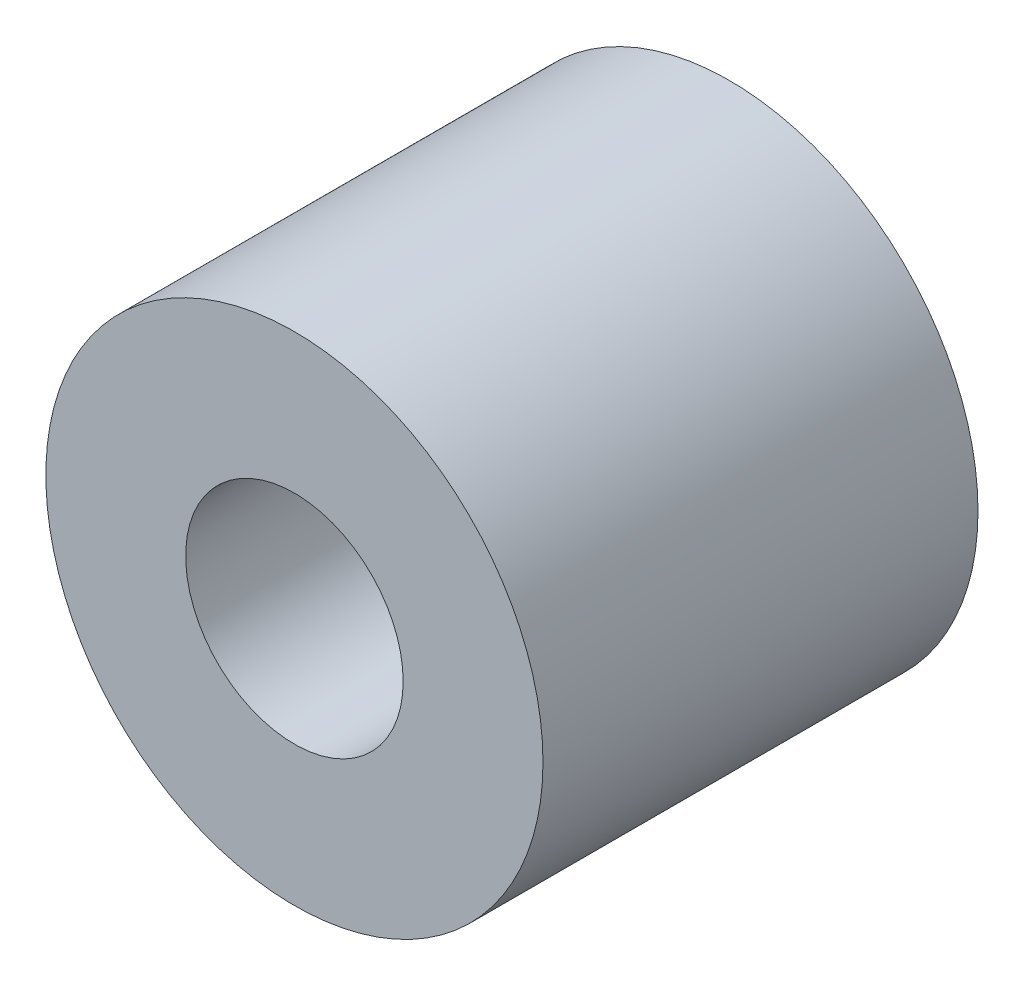
from build123d import *

# Parameters (mm, degrees)
SKETCH1_R           = 4
SKETCH1_R_2         = 1.75
BOSS_EXTRUDE1_DEPTH = 7


with BuildPart() as part:
    # Sketch1 → Boss-Extrude1 (new body)
    with BuildSketch(Plane.XY):
        Circle(SKETCH1_R)
        Circle(SKETCH1_R_2, mode=Mode.SUBTRACT)
    extrude(amount=BOSS_EXTRUDE1_DEPTH)


solid = part.part
